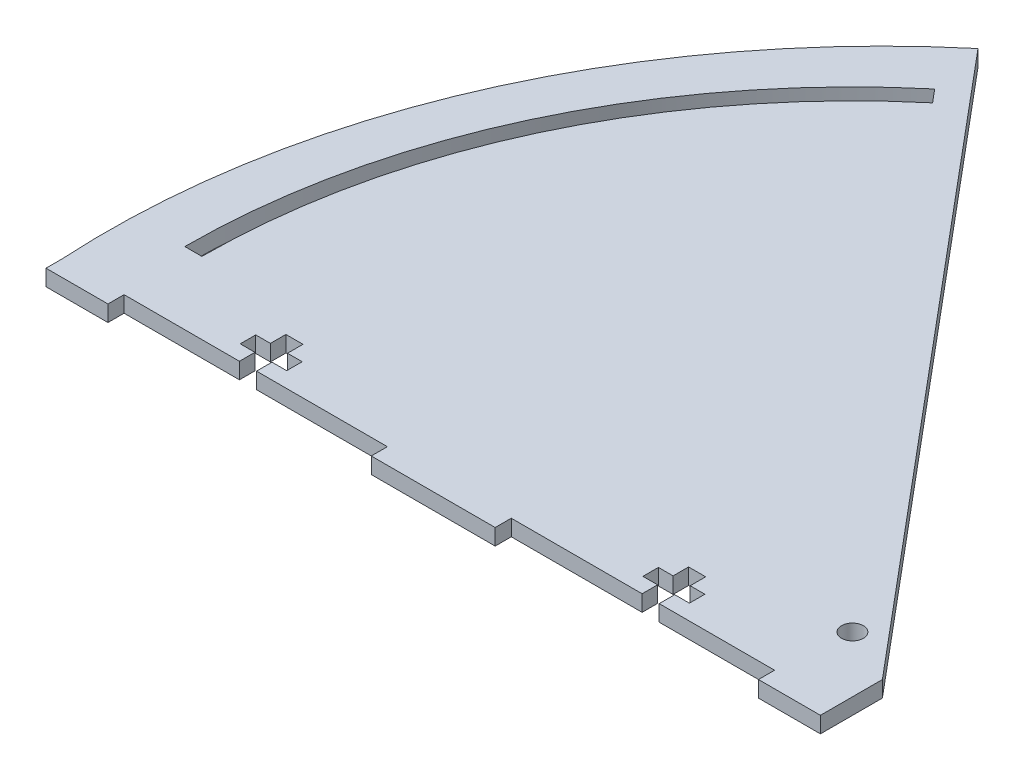
from build123d import *

# Parameters (mm, degrees)
SKETCH1_R           = 2.24506403
BOSS_EXTRUDE1_DEPTH = 3.302


with BuildPart() as part:
    # Sketch1 → Boss-Extrude1 (new body)
    with BuildSketch(Plane(origin=(0, 0, 0), x_dir=(1, 0, 0), z_dir=(0, 1, 0))):
        with BuildLine():
            Line((12.7, -3.302), (12.7, 0))
            Line((12.7, 0), (36.3474, 0))
            Line((36.3474, 0), (36.3474, 3.175))
            Line((36.3474, 3.175), (33.3375, 3.175))
            Line((33.3375, 3.175), (33.3375, 6.35))
            Line((33.3375, 6.35), (36.3474, 6.35))
            Line((36.3474, 6.35), (36.3474, 9.525))
            Line((36.3474, 9.525), (39.8526, 9.525))
            Line((39.8526, 9.525), (39.8526, 6.35))
            Line((39.8526, 6.35), (42.8625, 6.35))
            Line((42.8625, 6.35), (42.8625, 3.175))
            Line((42.8625, 3.175), (39.8526, 3.175))
            Line((39.8526, 3.175), (39.8526, 0))
            Line((39.8526, 0), (66.675, 0))
            Line((66.675, 0), (66.675, -3.302))
            Line((66.675, -3.302), (92.075, -3.302))
            Line((92.075, -3.302), (92.075, 0))
            Line((92.075, 0), (118.8974, 0))
            Line((118.8974, 0), (118.8974, 3.175))
            Line((118.8974, 3.175), (115.8875, 3.175))
            Line((115.8875, 3.175), (115.8875, 6.35))
            Line((115.8875, 6.35), (118.8974, 6.35))
            Line((118.8974, 6.35), (118.8974, 9.525))
            Line((118.8974, 9.525), (122.4026, 9.525))
            Line((122.4026, 9.525), (122.4026, 6.35))
            Line((122.4026, 6.35), (125.4125, 6.35))
            Line((125.4125, 6.35), (125.4125, 3.175))
            Line((125.4125, 3.175), (122.4026, 3.175))
            Line((122.4026, 3.175), (122.4026, 0))
            Line((122.4026, 0), (146.05, 0))
            Line((146.05, 0), (146.05, -3.302))
            Line((146.05, -3.302), (158.75, -3.302))
            Line((158.75, -3.302), (158.75, 9.398))
            Line((158.75, 9.398), (56.528812184, 131.220467819))
            ThreePointArc((56.528812184, 131.220467819), (12.697978408, 72.316136438), (0, 0))
            Line((0, 0), (0, -3.302))
            Line((0, -3.302), (12.7, -3.302))
        make_face()
        with Locations((147.239891105, 14.765251924)):
            Circle(SKETCH1_R, mode=Mode.SUBTRACT)
        with BuildLine():
            Line((13.889891105, 14.765251924), (10.384691105, 14.765251924))
            ThreePointArc((10.384691105, 14.765251924), (23.206957648, 72.602758658), (59.271064223, 119.602417396))
            Line((59.271064223, 119.602417396), (61.524163353, 116.917278414))
            ThreePointArc((61.524163353, 116.917278414), (26.383747703, 71.121397127), (13.889891105, 14.765251924))
        make_face(mode=Mode.SUBTRACT)
    extrude(amount=BOSS_EXTRUDE1_DEPTH)


solid = part.part
